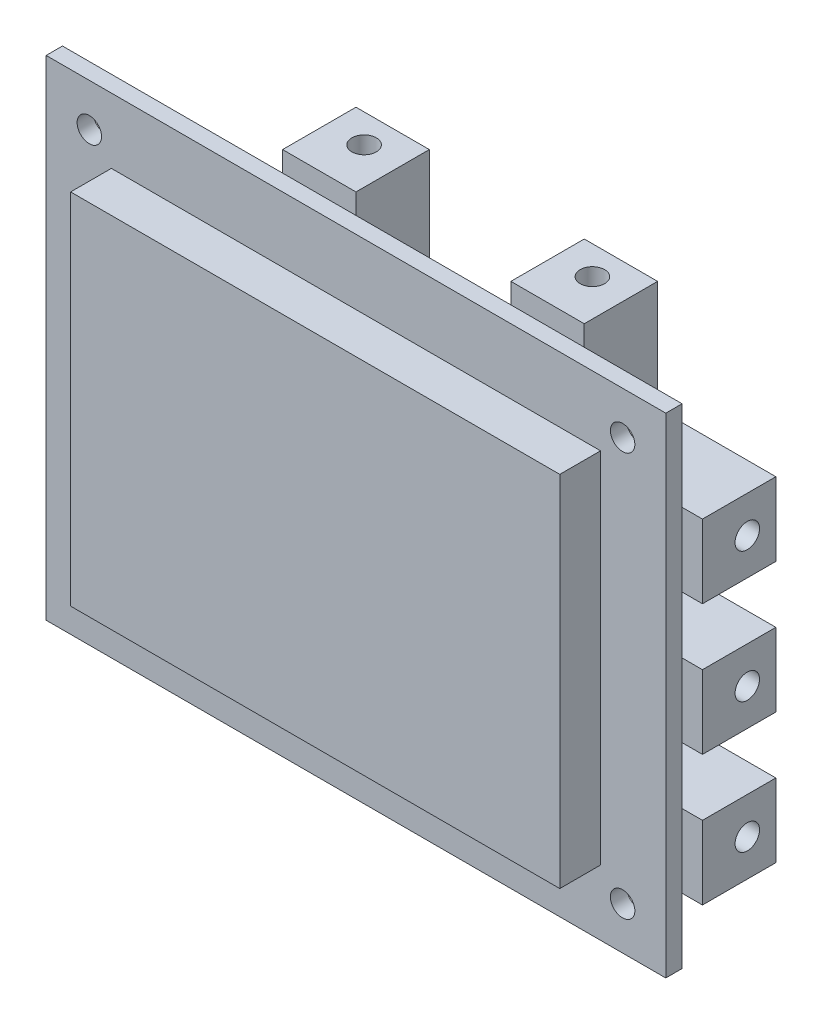
from build123d import *

# Parameters (mm, degrees)
SKETCH_1_W          = 76
SKETCH_1_H          = 60
SKETCH_1_R          = 1.5
EXTRUDE_1_DEPTH     = 2
SKETCH_2_W          = 60
SKETCH_2_H          = 44
EXTRUDE_2_DEPTH     = 5
SKETCH_3_W          = 12
SKETCH_3_H          = 9
SKETCH_3_W_2        = 9
SKETCH_3_H_2        = 12
SKETCH_3_W_3        = 35
SKETCH_3_H_3        = 5
SKETCH_3_W_4        = 5
SKETCH_3_H_4        = 10
EXTRUDE_3_DEPTH     = 9
SKETCH_4_R          = 1.5
CUT_EXTRUDE_1_DEPTH = 26
SKETCH_5_R          = 1.5
CUT_EXTRUDE_2_DEPTH = 26


with BuildPart() as part:
    # 草图1 → 凸台-拉伸1 (new body)
    with BuildSketch(Plane.XY):
        Rectangle(SKETCH_1_W, SKETCH_1_H)
        with Locations((-32.705, 24.765)):
            Circle(SKETCH_1_R, mode=Mode.SUBTRACT)
        with Locations((32.705, 24.765)):
            Circle(SKETCH_1_R, mode=Mode.SUBTRACT)
        with Locations((-32.705, -24.765)):
            Circle(SKETCH_1_R, mode=Mode.SUBTRACT)
        with Locations((32.705, -24.765)):
            Circle(SKETCH_1_R, mode=Mode.SUBTRACT)
    extrude(amount=EXTRUDE_1_DEPTH)

    # 草图2 → 凸台-拉伸2 (add)
    with BuildSketch(Plane.XY.offset(2)):
        Rectangle(SKETCH_2_W, SKETCH_2_H)
    extrude(amount=EXTRUDE_2_DEPTH)

    # 草图3 → 凸台-拉伸3 (add)
    with BuildSketch(Plane(origin=(0, 0, 0), x_dir=(-1, 0, 0), z_dir=(0, 0, -1))):
        with Locations((-34.5, -17.5)):
            Rectangle(SKETCH_3_W, SKETCH_3_H)
        with Locations((-34.5, -1.5)):
            Rectangle(SKETCH_3_W, SKETCH_3_H)
        with Locations((-34.5, 14.5)):
            Rectangle(SKETCH_3_W, SKETCH_3_H)
        with Locations((-21.5, 26.5)):
            Rectangle(SKETCH_3_W_2, SKETCH_3_H_2)
        with Locations((6.5, 26.5)):
            Rectangle(SKETCH_3_W_2, SKETCH_3_H_2)
        with Locations((11.5, -27.5)):
            Rectangle(SKETCH_3_W_3, SKETCH_3_H_3)
        with Locations((35.5, -17.5)):
            Rectangle(SKETCH_3_W_4, SKETCH_3_H_4)
    extrude(amount=EXTRUDE_3_DEPTH)

    # 草图4 → 切除-拉伸1 (cut)
    with BuildSketch(Plane(origin=(40.5, 0, 0), x_dir=(0, 0, -1), z_dir=(1, 0, 0))):
        with Locations((5.5, -17.5)):
            Circle(SKETCH_4_R)
        with Locations((5.5, -1.5)):
            Circle(SKETCH_4_R)
        with Locations((5.5, 14.5)):
            Circle(SKETCH_4_R)
    extrude(amount=-CUT_EXTRUDE_1_DEPTH, mode=Mode.SUBTRACT)

    # 草图5 → 切除-拉伸2 (cut)
    with BuildSketch(Plane(origin=(0, 32.5, 0), x_dir=(1, 0, 0), z_dir=(0, 1, 0))):
        with Locations(Location((21.5, 5.5, 0), (0, 0, 270))):
            Circle(SKETCH_5_R)
        with Locations(Location((-6.5, 5.5, 0), (0, 0, 270))):
            Circle(SKETCH_5_R)
    extrude(amount=-CUT_EXTRUDE_2_DEPTH, mode=Mode.SUBTRACT)


solid = part.part
